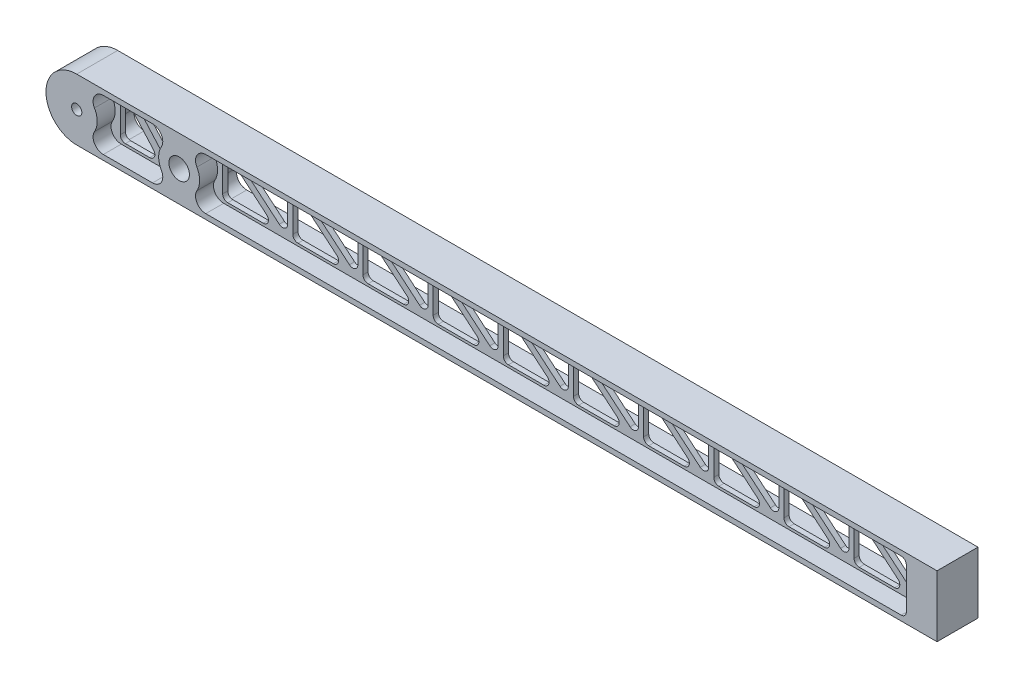
from build123d import *

# Parameters (mm, degrees)
BOSS_EXTRUDE1_DEPTH = 12.7
SKETCH1_10_R        = 3.175
SKETCH1_10_R_2      = 6.35
CUT_EXTRUDE3_DEPTH  = 12.7
CUT_EXTRUDE5_DEPTH  = 535.344104955
CUT_EXTRUDE7_DEPTH  = 11.1125
FILLET1_R           = 3.175


with BuildPart() as part:
    # Sketch1 → Boss-Extrude1 (new, symmetric)
    with BuildSketch(Plane.XY):
        with BuildLine():
            Line((533.4, -19.05), (533.4, 19.05))
            Line((533.4, 19.05), (0, 19.05))
            ThreePointArc((0, 19.05), (-19.05, 0), (0, -19.05))
            Line((0, -19.05), (533.4, -19.05))
        make_face()
    extrude(amount=BOSS_EXTRUDE1_DEPTH, both=True)

    # Sketch1<10> → Cut-Extrude3 (cut, symmetric)
    with BuildSketch(Plane.XY):
        Circle(SKETCH1_10_R)
        with Locations((63.5, 0)):
            Circle(SKETCH1_10_R_2)
    extrude(amount=CUT_EXTRUDE3_DEPTH, both=True, mode=Mode.SUBTRACT)

    # Sketch3 → Cut-Extrude5 (cut, through all)
    with BuildSketch(Plane.XY.offset(12.7)):
        Polygon((41.229549912, -14.2875), (15.875, 14.2875), (15.875, -14.2875), align=None)
        Polygon((22.270450088, 14.2875), (47.625, -14.2875), (47.625, 14.2875), align=None)
        Polygon((113.255197252, -14.2875), (79.375, 14.2875), (79.375, -14.2875), align=None)
        Polygon((85.817302748, 14.2875), (119.6975, -14.2875), (119.6975, 14.2875), align=None)
        Polygon((156.752697252, -14.2875), (122.8725, 14.2875), (122.8725, -14.2875), align=None)
        Polygon((129.314802748, 14.2875), (163.195, -14.2875), (163.195, 14.2875), align=None)
        Polygon((200.250197252, -14.2875), (166.37, 14.2875), (166.37, -14.2875), align=None)
        Polygon((172.812302748, 14.2875), (206.6925, -14.2875), (206.6925, 14.2875), align=None)
        Polygon((243.747697252, -14.2875), (209.8675, 14.2875), (209.8675, -14.2875), align=None)
        Polygon((216.309802748, 14.2875), (250.19, -14.2875), (250.19, 14.2875), align=None)
        Polygon((287.245197252, -14.2875), (253.365, 14.2875), (253.365, -14.2875), align=None)
        Polygon((259.807302748, 14.2875), (293.6875, -14.2875), (293.6875, 14.2875), align=None)
        Polygon((330.742697252, -14.2875), (296.8625, 14.2875), (296.8625, -14.2875), align=None)
        Polygon((303.304802748, 14.2875), (337.185, -14.2875), (337.185, 14.2875), align=None)
        Polygon((374.240197252, -14.2875), (340.36, 14.2875), (340.36, -14.2875), align=None)
        Polygon((346.802302748, 14.2875), (380.6825, -14.2875), (380.6825, 14.2875), align=None)
        Polygon((417.737697252, -14.2875), (383.8575, 14.2875), (383.8575, -14.2875), align=None)
        Polygon((390.299802748, 14.2875), (424.18, -14.2875), (424.18, 14.2875), align=None)
        Polygon((461.235197252, -14.2875), (427.355, 14.2875), (427.355, -14.2875), align=None)
        Polygon((433.797302748, 14.2875), (467.6775, -14.2875), (467.6775, 14.2875), align=None)
        Polygon((504.732697252, -14.2875), (470.8525, 14.2875), (470.8525, -14.2875), align=None)
        Polygon((477.294802748, 14.2875), (511.175, -14.2875), (511.175, 14.2875), align=None)
    extrude(amount=-CUT_EXTRUDE5_DEPTH, mode=Mode.SUBTRACT)

    # Sketch3<5> → Cut-Extrude7 (cut)
    # profile 1 of 2: a face of its own
    with BuildSketch(Plane.XY.offset(12.7)):
        with BuildLine():
            ThreePointArc((10.998522628, -6.35), (10.998522628, -12.7), (16.497783942, -15.875))
            Line((16.497783942, -15.875), (47.002216058, -15.875))
            ThreePointArc((47.002216058, -15.875), (52.501477372, -12.7), (52.501477372, -6.35))
            ThreePointArc((52.501477372, -6.35), (50.8, 0), (52.501477372, 6.35))
            ThreePointArc((52.501477372, 6.35), (52.501477372, 12.7), (47.002216058, 15.875))
            Line((47.002216058, 15.875), (16.497783942, 15.875))
            ThreePointArc((16.497783942, 15.875), (10.998522628, 12.7), (10.998522628, 6.35))
            ThreePointArc((10.998522628, 6.35), (12.7, 0), (10.998522628, -6.35))
        make_face()
        Polygon((47.625, -14.2875), (32.130552832, 3.175), (22.270450088, 14.2875), (47.625, 14.2875), align=None, mode=Mode.SUBTRACT)
        Polygon((15.875, -14.2875), (15.875, 14.2875), (28.552274956, 0), (41.229549912, -14.2875), align=None, mode=Mode.SUBTRACT)
    # profile 2 of 2: a face of its own
    with BuildSketch(Plane.XY.offset(12.7)):
        with BuildLine():
            ThreePointArc((79.997783942, 15.875), (74.498522628, 12.7), (74.498522628, 6.35))
            ThreePointArc((74.498522628, 6.35), (76.2, 0), (74.498522628, -6.35))
            ThreePointArc((74.498522628, -6.35), (74.498522628, -12.7), (79.997783942, -15.875))
            Line((79.997783942, -15.875), (514.35, -15.875))
            Line((514.35, -15.875), (514.35, 15.875))
            Line((514.35, 15.875), (79.997783942, 15.875))
        make_face()
        Polygon((119.6975, -14.2875), (98.992935013, 3.175), (85.817302748, 14.2875), (119.6975, 14.2875), align=None, mode=Mode.SUBTRACT)
        Polygon((163.195, -14.2875), (142.490435013, 3.175), (129.314802748, 14.2875), (163.195, 14.2875), align=None, mode=Mode.SUBTRACT)
        Polygon((250.19, -14.2875), (229.485435013, 3.175), (216.309802748, 14.2875), (250.19, 14.2875), align=None, mode=Mode.SUBTRACT)
        Polygon((337.185, -14.2875), (316.480435013, 3.175), (303.304802748, 14.2875), (337.185, 14.2875), align=None, mode=Mode.SUBTRACT)
        Polygon((424.18, -14.2875), (403.475435013, 3.175), (390.299802748, 14.2875), (424.18, 14.2875), align=None, mode=Mode.SUBTRACT)
        Polygon((511.175, -14.2875), (490.470435013, 3.175), (477.294802748, 14.2875), (511.175, 14.2875), align=None, mode=Mode.SUBTRACT)
        Polygon((79.375, -14.2875), (79.375, 14.2875), (96.315098626, 0), (113.255197252, -14.2875), align=None, mode=Mode.SUBTRACT)
        Polygon((122.8725, -14.2875), (122.8725, 14.2875), (139.812598626, 0), (156.752697252, -14.2875), align=None, mode=Mode.SUBTRACT)
        Polygon((166.37, -14.2875), (166.37, 14.2875), (183.310098626, 0), (200.250197252, -14.2875), align=None, mode=Mode.SUBTRACT)
        Polygon((206.6925, -14.2875), (185.987935013, 3.175), (172.812302748, 14.2875), (206.6925, 14.2875), align=None, mode=Mode.SUBTRACT)
        Polygon((209.8675, -14.2875), (209.8675, 14.2875), (226.807598626, 0), (243.747697252, -14.2875), align=None, mode=Mode.SUBTRACT)
        Polygon((253.365, -14.2875), (253.365, 14.2875), (270.305098626, 0), (287.245197252, -14.2875), align=None, mode=Mode.SUBTRACT)
        Polygon((293.6875, -14.2875), (272.982935013, 3.175), (259.807302748, 14.2875), (293.6875, 14.2875), align=None, mode=Mode.SUBTRACT)
        Polygon((296.8625, -14.2875), (296.8625, 14.2875), (313.802598626, 0), (330.742697252, -14.2875), align=None, mode=Mode.SUBTRACT)
        Polygon((340.36, -14.2875), (340.36, 14.2875), (357.300098626, 0), (374.240197252, -14.2875), align=None, mode=Mode.SUBTRACT)
        Polygon((380.6825, -14.2875), (359.977935013, 3.175), (346.802302748, 14.2875), (380.6825, 14.2875), align=None, mode=Mode.SUBTRACT)
        Polygon((383.8575, -14.2875), (383.8575, 14.2875), (400.797598626, 0), (417.737697252, -14.2875), align=None, mode=Mode.SUBTRACT)
        Polygon((427.355, -14.2875), (427.355, 14.2875), (444.295098626, 0), (461.235197252, -14.2875), align=None, mode=Mode.SUBTRACT)
        Polygon((467.6775, -14.2875), (446.972935013, 3.175), (433.797302748, 14.2875), (467.6775, 14.2875), align=None, mode=Mode.SUBTRACT)
        Polygon((470.8525, -14.2875), (470.8525, 14.2875), (487.792598626, 0), (504.732697252, -14.2875), align=None, mode=Mode.SUBTRACT)
    cut_extrude7 = extrude(amount=-CUT_EXTRUDE7_DEPTH, mode=Mode.SUBTRACT)

    # Mirror1: Cut-Extrude7 across plane
    add(cut_extrude7.mirror(Plane.XY), mode=Mode.SUBTRACT)

    # Fillet1
    fillet1_edges = [part.edges().sort_by_distance(p)[0] for p in [
        (119.6975, 14.2875, 0),
        (119.6975, -14.2875, 0),
        (85.817302748, 14.2875, 0),
        (163.195, 14.2875, 0),
        (163.195, -14.2875, 0),
        (129.314802748, 14.2875, 0),
        (206.6925, 14.2875, 0),
        (206.6925, -14.2875, 0),
        (172.812302748, 14.2875, 0),
        (250.19, 14.2875, 0),
        (250.19, -14.2875, 0),
        (216.309802748, 14.2875, 0),
        (293.6875, 14.2875, 0),
        (293.6875, -14.2875, 0),
        (259.807302748, 14.2875, 0),
        (337.185, 14.2875, 0),
        (337.185, -14.2875, 0),
        (303.304802748, 14.2875, 0),
        (380.6825, 14.2875, 0),
        (380.6825, -14.2875, 0),
        (346.802302748, 14.2875, 0),
        (424.18, 14.2875, 0),
        (424.18, -14.2875, 0),
        (390.299802748, 14.2875, 0),
        (467.6775, 14.2875, 0),
        (467.6775, -14.2875, 0),
        (433.797302748, 14.2875, 0),
        (511.175, 14.2875, 0),
        (511.175, -14.2875, 0),
        (477.294802748, 14.2875, 0),
        (79.375, 14.2875, 0),
        (113.255197252, -14.2875, 0),
        (122.8725, 14.2875, 0),
        (156.752697252, -14.2875, 0),
        (122.8725, -14.2875, 0),
        (166.37, 14.2875, 0),
        (200.250197252, -14.2875, 0),
        (166.37, -14.2875, 0),
        (209.8675, 14.2875, 0),
        (243.747697252, -14.2875, 0),
        (209.8675, -14.2875, 0),
        (253.365, 14.2875, 0),
        (287.245197252, -14.2875, 0),
        (253.365, -14.2875, 0),
        (296.8625, 14.2875, 0),
        (330.742697252, -14.2875, 0),
        (296.8625, -14.2875, 0),
        (340.36, 14.2875, 0),
        (374.240197252, -14.2875, 0),
        (340.36, -14.2875, 0),
        (383.8575, 14.2875, 0),
        (417.737697252, -14.2875, 0),
        (383.8575, -14.2875, 0),
        (427.355, 14.2875, 0),
        (461.235197252, -14.2875, 0),
        (427.355, -14.2875, 0),
        (470.8525, 14.2875, 0),
        (504.732697252, -14.2875, 0),
        (470.8525, -14.2875, 0),
        (79.375, -14.2875, 0),
        (22.270450088, 14.2875, 0),
        (47.625, 14.2875, 0),
        (47.625, -14.2875, 0),
        (41.229549912, -14.2875, 0),
        (15.875, 14.2875, 0),
        (15.875, -14.2875, 0),
        (514.35, -15.875, 7.14375),
        (514.35, 15.875, 7.14375),
    ]]
    fillet(fillet1_edges, radius=FILLET1_R)


solid = part.part
